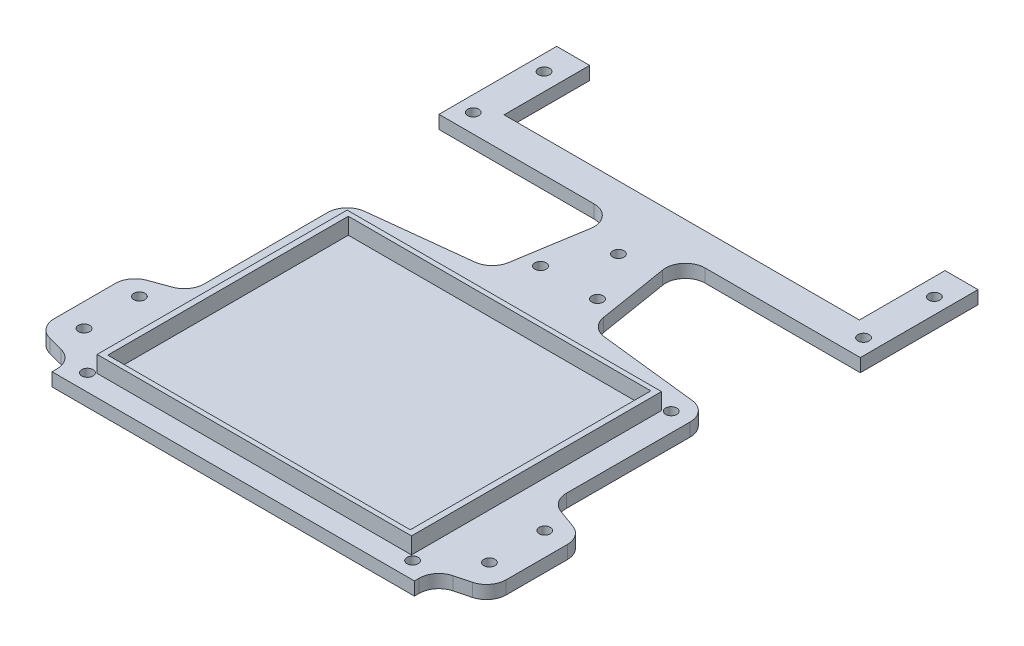
from build123d import *

# Parameters (mm, degrees)
SKETCH1_R           = 1.7
BOSS_EXTRUDE2_DEPTH = 4
SKETCH4_W           = 95.436014614
SKETCH4_H           = 75.892817578
SKETCH4_W_2         = 91.839367952
SKETCH4_H_2         = 73.032685056
BOSS_EXTRUDE5_DEPTH = 5


with BuildPart() as part:
    # Sketch1 → Boss-Extrude2 (new body)
    with BuildSketch(Plane(origin=(0, 0, 0), x_dir=(1, 0, 0), z_dir=(0, 1, 0))):
        with BuildLine():
            Line((55, -97.276480298), (-55, -97.276480298))
            Line((-55, -97.276480298), (-55, -95.836582418))
            ThreePointArc((-55, -95.836582418), (-56.256563164, -92.16237407), (-59.499935661, -90.027124011))
            Line((-59.499935661, -90.027124011), (-64.123335896, -88.833312587))
            ThreePointArc((-64.123335896, -88.833312587), (-67.366708393, -86.698062528), (-68.623271557, -83.02385418))
            Line((-68.623271557, -83.02385418), (-68.623271557, -64.477065442))
            ThreePointArc((-68.623271557, -64.477065442), (-67.538437873, -61.035969674), (-64.676224862, -58.839212772))
            Line((-64.676224862, -58.839212772), (-58.952120675, -56.75485206))
            ThreePointArc((-58.952120675, -56.75485206), (-56.08783115, -54.555127217), (-55.005078353, -51.109754923))
            Line((-55.005078353, -51.109754923), (-55.050338054, -13.624867313))
            ThreePointArc((-55.050338054, -13.624867313), (-53.526628764, -9.622267963), (-49.722190465, -7.65535648))
            Line((-49.722190465, -7.65535648), (-19.667476765, -4.268691216))
            ThreePointArc((-19.667476765, -4.268691216), (-16.201629955, -2.651477365), (-14.417006114, 0.731212762))
            Line((-14.417006114, 0.731212762), (-10.931405786, 22.181381875))
            ThreePointArc((-10.931405786, 22.181381875), (-12.283485184, 27.031277264), (-16.853724474, 29.143744262))
            Line((-16.853724474, 29.143744262), (-63.956383701, 29.143744262))
            Line((-63.956383701, 29.143744262), (-63.956383701, 64.872936213))
            Line((-63.956383701, 64.872936213), (-53.943716214, 64.872936213))
            Line((-53.943716214, 64.872936213), (-53.943716214, 38.878522988))
            Line((-53.943716214, 38.878522988), (53.943716214, 38.878522988))
            Line((53.943716214, 38.878522988), (53.943716214, 64.872936213))
            Line((53.943716214, 64.872936213), (63.956383701, 64.872936213))
            Line((63.956383701, 64.872936213), (63.956383701, 29.143744262))
            Line((63.956383701, 29.143744262), (16.853724474, 29.143744262))
            ThreePointArc((16.853724474, 29.143744262), (12.283485184, 27.031277264), (10.931405786, 22.181381875))
            Line((10.931405786, 22.181381875), (14.417006114, 0.731212762))
            ThreePointArc((14.417006114, 0.731212762), (16.201629955, -2.651477365), (19.667476765, -4.268691216))
            Line((19.667476765, -4.268691216), (49.722190465, -7.65535648))
            ThreePointArc((49.722190465, -7.65535648), (53.526628764, -9.622267963), (55.050338054, -13.624867313))
            Line((55.050338054, -13.624867313), (55.005078353, -51.109754923))
            ThreePointArc((55.005078353, -51.109754923), (56.08783115, -54.555127217), (58.952120675, -56.75485206))
            Line((58.952120675, -56.75485206), (64.676224862, -58.839212772))
            ThreePointArc((64.676224862, -58.839212772), (67.538437873, -61.035969674), (68.623271557, -64.477065442))
            Line((68.623271557, -64.477065442), (68.623271557, -83.02385418))
            ThreePointArc((68.623271557, -83.02385418), (67.366708393, -86.698062528), (64.123335896, -88.833312587))
            Line((64.123335896, -88.833312587), (59.499935661, -90.027124011))
            ThreePointArc((59.499935661, -90.027124011), (56.256563164, -92.16237407), (55, -95.836582418))
            Line((55, -95.836582418), (55, -97.276480298))
        make_face()
        with Locations(Location((-59.25, 56.33553485, 0), (0, 0, 270))):
            Circle(SKETCH1_R, mode=Mode.SUBTRACT)
        with Locations(Location((-59.25, 34.83553485, 0), (0, 0, 270))):
            Circle(SKETCH1_R, mode=Mode.SUBTRACT)
        with Locations(Location((59.25, 34.83553485, 0), (0, 0, 270))):
            Circle(SKETCH1_R, mode=Mode.SUBTRACT)
        with Locations(Location((59.25, 56.33553485, 0), (0, 0, 270))):
            Circle(SKETCH1_R, mode=Mode.SUBTRACT)
        with Locations(Location((0, 19.658684952, 0), (0, 0, 270))):
            Circle(SKETCH1_R, mode=Mode.SUBTRACT)
        with Locations(Location((61.535021632, -64.239476302, 0), (0, 0, 270))):
            Circle(SKETCH1_R, mode=Mode.SUBTRACT)
        with Locations(Location((-8.660254038, 4.658684952, 0), (0, 0, 270))):
            Circle(SKETCH1_R, mode=Mode.SUBTRACT)
        with Locations(Location((8.660254038, 4.658684952, 0), (0, 0, 270))):
            Circle(SKETCH1_R, mode=Mode.SUBTRACT)
        with Locations(Location((61.535021632, -81.039476302, 0), (0, 0, 270))):
            Circle(SKETCH1_R, mode=Mode.SUBTRACT)
        with Locations(Location((-61.535021632, -81.039476302, 0), (0, 0, 270))):
            Circle(SKETCH1_R, mode=Mode.SUBTRACT)
        with Locations(Location((-61.535021632, -64.239476302, 0), (0, 0, 270))):
            Circle(SKETCH1_R, mode=Mode.SUBTRACT)
        with Locations(Location((-49.365711, -13.675658, 0), (0, 0, 270))):
            Circle(SKETCH1_R, mode=Mode.SUBTRACT)
        with Locations(Location((-49.365711, -92.189056, 0), (0, 0, 270))):
            Circle(SKETCH1_R, mode=Mode.SUBTRACT)
        with Locations(Location((49.365711, -92.189056, 0), (0, 0, 270))):
            Circle(SKETCH1_R, mode=Mode.SUBTRACT)
        with Locations(Location((49.365711, -13.675658, 0), (0, 0, 270))):
            Circle(SKETCH1_R, mode=Mode.SUBTRACT)
    extrude(amount=BOSS_EXTRUDE2_DEPTH)

    # Sketch4 → Boss-Extrude5 (add)
    with BuildSketch(Plane(origin=(0, 4, 0), x_dir=(1, 0, 0), z_dir=(0, 1, 0))):
        with Locations((0, -52.932357)):
            Rectangle(SKETCH4_W, SKETCH4_H)
        with Locations((0, -52.932357)):
            Rectangle(SKETCH4_W_2, SKETCH4_H_2, mode=Mode.SUBTRACT)
    extrude(amount=BOSS_EXTRUDE5_DEPTH)


solid = part.part
